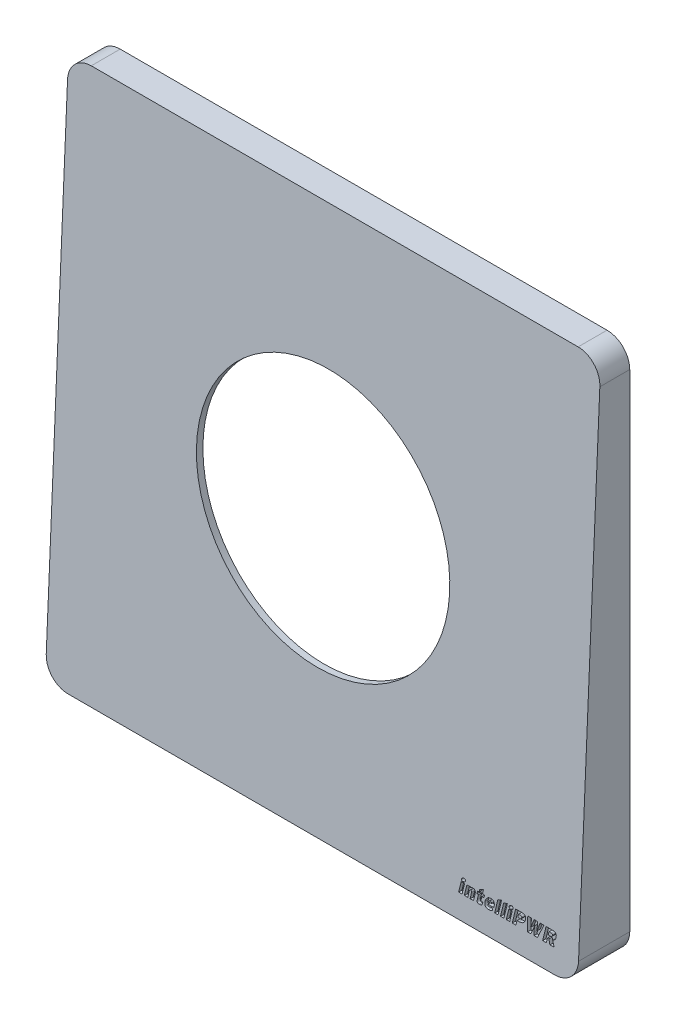
from build123d import *

# Parameters (mm, degrees)
EXTRUDE_THIN1_DEPTH     = 8
CUT_EXTRUDE2_DEPTH      = 120
BOSS_EXTRUDE1_DEPTH     = 82
CUT_EXTRUDE_THIN1_DEPTH = 82
SKETCH8_R               = 19.5
CUT_EXTRUDE3_DEPTH      = 82
CUT_EXTRUDE13_DEPTH     = 0.5


with BuildPart() as part:
    # Sketch1 → Extrude-Thin1 (new body)
    with BuildSketch(Plane.XY):
        with BuildLine():
            Line((-37.5, 41), (37.5, 41))
            ThreePointArc((37.5, 41), (39.974873734, 39.974873734), (41, 37.5))
            Line((41, 37.5), (41, -37.5))
            ThreePointArc((41, -37.5), (39.974873734, -39.974873734), (37.5, -41))
            Line((37.5, -41), (-37.5, -41))
            ThreePointArc((-37.5, -41), (-39.974873734, -39.974873734), (-41, -37.5))
            Line((-41, -37.5), (-41, 37.5))
            ThreePointArc((-41, 37.5), (-39.974873734, 39.974873734), (-37.5, 41))
        make_face()
        with BuildLine():
            Line((-37.5, 40), (37.5, 40))
            ThreePointArc((37.5, 40), (39.267766953, 39.267766953), (40, 37.5))
            Line((40, 37.5), (40, -37.5))
            ThreePointArc((40, -37.5), (39.267766953, -39.267766953), (37.5, -40))
            Line((37.5, -40), (-37.5, -40))
            ThreePointArc((-37.5, -40), (-39.267766953, -39.267766953), (-40, -37.5))
            Line((-40, -37.5), (-40, 37.5))
            ThreePointArc((-40, 37.5), (-39.267766953, 39.267766953), (-37.5, 40))
        make_face(mode=Mode.SUBTRACT)
    extrude(amount=EXTRUDE_THIN1_DEPTH)

    # Sketch5 → Cut-Extrude2 (cut)
    with BuildSketch(Plane(origin=(41, 0, 0), x_dir=(0, 0, -1), z_dir=(1, 0, 0))):
        Polygon((-3.45625, 41), (-8, 41), (-8, -41), (-7.04375, -41), align=None)
    extrude(amount=-CUT_EXTRUDE2_DEPTH, mode=Mode.SUBTRACT)

    # Sketch6 → Boss-Extrude1 (add)
    with BuildSketch(Plane(origin=(41, 0, 0), x_dir=(0, 0, -1), z_dir=(1, 0, 0))):
        Polygon((-7.04375, -41), (-3.45625, 41), (-4.457206574, 41), (-8.044706574, -41), align=None)
    extrude(amount=-BOSS_EXTRUDE1_DEPTH)

    # Sketch7 → Cut-Extrude-Thin1 (cut)
    with BuildSketch(Plane(origin=(0, 0, 0), x_dir=(-1, 0, 0), z_dir=(0, 0, -1))):
        with BuildLine():
            Line((-37.5, 52), (37.5, 52))
            ThreePointArc((37.5, 52), (47.753048327, 47.753048327), (52, 37.5))
            Line((52, 37.5), (52, -37.5))
            ThreePointArc((52, -37.5), (47.753048327, -47.753048327), (37.5, -52))
            Line((37.5, -52), (-37.5, -52))
            ThreePointArc((-37.5, -52), (-47.753048327, -47.753048327), (-52, -37.5))
            Line((-52, -37.5), (-52, 37.5))
            ThreePointArc((-52, 37.5), (-47.753048327, 47.753048327), (-37.5, 52))
        make_face()
        with BuildLine():
            Line((-37.5, 41), (37.5, 41))
            ThreePointArc((37.5, 41), (39.974873734, 39.974873734), (41, 37.5))
            Line((41, 37.5), (41, -37.5))
            ThreePointArc((41, -37.5), (39.974873734, -39.974873734), (37.5, -41))
            Line((37.5, -41), (-37.5, -41))
            ThreePointArc((-37.5, -41), (-39.974873734, -39.974873734), (-41, -37.5))
            Line((-41, -37.5), (-41, 37.5))
            ThreePointArc((-41, 37.5), (-39.974873734, 39.974873734), (-37.5, 41))
        make_face(mode=Mode.SUBTRACT)
    extrude(amount=-CUT_EXTRUDE_THIN1_DEPTH, mode=Mode.SUBTRACT)

    # Sketch8 → Cut-Extrude3 (cut)
    with BuildSketch(Plane(origin=(0, 0.272956894, 6.23901471), x_dir=(1, 0, 0), z_dir=(0, 0.043708189893615426, 0.9990443404255007))):
        with Locations(Location((0, 0, 0), (0, 0, 270))):
            Circle(SKETCH8_R)
    extrude(amount=-CUT_EXTRUDE3_DEPTH, mode=Mode.SUBTRACT)

    # Sketch9 → Cut-Extrude13 (cut)
    # profile 1 of 12: a face of its own
    with BuildSketch(Plane(origin=(0, 0.272956894, 6.23901471), x_dir=(1, 0, 0), z_dir=(0, 0.043708189893615426, 0.9990443404255007))):
        Polygon((22.531822821, -37.81243752), (22.856252467, -36.277424239), (23.382446053, -36.277424239), (23.058016406, -37.81243752), align=None)
    # profile 2 of 12: a face of its own
    with BuildSketch(Plane(origin=(0, 0.272956894, 6.23901471), x_dir=(1, 0, 0), z_dir=(0, 0.043708189893615426, 0.9990443404255007))):
        with BuildLine():
            Line((24.290595271, -37.81243752), (24.474593832, -36.930090398))
            add(Edge.make_bspline(
                [(24.474593832, -36.930090398), (24.478802242, -36.907040936), (24.485699122, -36.874149701), (24.489204408, -36.831864189), (24.489786804, -36.805005948), (24.488227016, -36.781187681), (24.484505468, -36.760299642), (24.478846794, -36.742301837), (24.467897911, -36.722954035), (24.449713773, -36.703469949), (24.410825862, -36.680379912), (24.375667943, -36.67553935), (24.351928125, -36.675453309)],
                knots=[0, 0, 0, 0, 0.206248224, 0.294567954, 0.37266766, 0.442257727, 0.504010297, 0.558886264, 0.607164005, 0.698384721, 0.78958017, 1, 1, 1, 1], degree=3))
            add(Edge.make_bspline(
                [(24.351928125, -36.675453309), (24.325473284, -36.67484558), (24.286525614, -36.681302878), (24.239553647, -36.702765608), (24.213865624, -36.721381884), (24.194964801, -36.739763636), (24.182562108, -36.757605017), (24.170154917, -36.777822133), (24.158964314, -36.801354271), (24.147757062, -36.827440773), (24.134571616, -36.86862437), (24.125790697, -36.901180323), (24.120978207, -36.924168606)],
                knots=[0, 0, 0, 0, 0.211446307, 0.310998659, 0.41131055, 0.464021143, 0.521401463, 0.584741643, 0.653943237, 0.72987757, 0.812025534, 1, 1, 1, 1], degree=3))
            Line((24.120978207, -36.924168606), (23.936556661, -37.81243752))
            Line((23.936556661, -37.81243752), (23.410363076, -37.81243752))
            Line((23.410363076, -37.81243752), (23.734792722, -36.26938752))
            Line((23.734792722, -36.26938752), (24.260986308, -36.26938752))
            Line((24.260986308, -36.26938752), (24.240683018, -36.373441879))
            add(Edge.make_bspline(
                [(24.240683018, -36.373441879), (24.297987543, -36.33807022), (24.373085655, -36.296555731), (24.471607475, -36.262409613), (24.549233248, -36.246533575), (24.610636762, -36.242418025), (24.653093586, -36.242316467)],
                knots=[0, 0, 0, 0, 0.46054381, 0.581347921, 0.710250487, 1, 1, 1, 1], degree=3))
            add(Edge.make_bspline(
                [(24.653093586, -36.242316467), (24.692136802, -36.242431818), (24.748815156, -36.246238609), (24.8195399, -36.26391656), (24.865428391, -36.281339933), (24.906090192, -36.304634337), (24.94136314, -36.333047361), (24.971485528, -36.366619173), (24.996169238, -36.405109022), (25.015420474, -36.448469614), (25.030965908, -36.495857326), (25.040105685, -36.548112348), (25.04586972, -36.604390706), (25.045678226, -36.66521683), (25.04090151, -36.755484326), (25.027642856, -36.824675469), (25.018552796, -36.872141426)],
                knots=[0, 0, 0, 0, 0.133987507, 0.193275728, 0.24925757, 0.301629359, 0.35316106, 0.403792674, 0.455518759, 0.509134706, 0.565968881, 0.625945932, 0.6905051, 0.759590801, 0.83411591, 1, 1, 1, 1], degree=3))
            Line((25.018552796, -36.872141426), (24.819749753, -37.81243752))
            Line((24.819749753, -37.81243752), (24.290595271, -37.81243752))
        make_face()
    # profile 3 of 12: a face of its own
    with BuildSketch(Plane(origin=(0, 0.272956894, 6.23901471), x_dir=(1, 0, 0), z_dir=(0, 0.043708189893615426, 0.9990443404255007))):
        with BuildLine():
            Line((25.394586637, -37.347153803), (25.534594737, -36.675453309))
            Line((25.534594737, -36.675453309), (25.300683923, -36.675453309))
            Line((25.300683923, -36.675453309), (25.388664844, -36.26938752))
            Line((25.388664844, -36.26938752), (25.622575658, -36.26938752))
            Line((25.622575658, -36.26938752), (25.704211801, -35.881087109))
            Line((25.704211801, -35.881087109), (26.259591365, -35.673824362))
            Line((26.259591365, -35.673824362), (26.133964762, -36.26938752))
            Line((26.133964762, -36.26938752), (26.467277097, -36.26938752))
            Line((26.467277097, -36.26938752), (26.379719161, -36.675453309))
            Line((26.379719161, -36.675453309), (26.046406826, -36.675453309))
            Line((26.046406826, -36.675453309), (25.929239926, -37.238869592))
            add(Edge.make_bspline(
                [(25.929239926, -37.238869592), (25.923631424, -37.263216042), (25.918218034, -37.297200918), (25.92312076, -37.33870405), (25.933824276, -37.360093), (25.95091673, -37.374576816), (25.981808804, -37.389433205), (26.009637148, -37.390972473), (26.028641447, -37.391567249)],
                knots=[0, 0, 0, 0, 0.332431059, 0.451864296, 0.549008946, 0.641835514, 0.743993136, 1, 1, 1, 1], degree=3))
            add(Edge.make_bspline(
                [(26.028641447, -37.391567249), (26.064780722, -37.392002115), (26.110181113, -37.38175387), (26.162442535, -37.359627978), (26.203981464, -37.340089416), (26.235299865, -37.32233029), (26.257053454, -37.309931106)],
                knots=[0, 0, 0, 0, 0.43902333, 0.560347006, 0.693743593, 1, 1, 1, 1], degree=3))
            Line((26.257053454, -37.309931106), (26.092935197, -37.757449444))
            add(Edge.make_bspline(
                [(26.092935197, -37.757449444), (26.033275974, -37.783688944), (25.9542673, -37.808911724), (25.856030319, -37.827809595), (25.785408909, -37.836780083), (25.731643106, -37.839786288), (25.695329112, -37.839508573)],
                knots=[0, 0, 0, 0, 0.477930884, 0.605353718, 0.733676339, 1, 1, 1, 1], degree=3))
            add(Edge.make_bspline(
                [(25.695329112, -37.839508573), (25.663071209, -37.839736582), (25.616436461, -37.836590683), (25.557875684, -37.82439235), (25.519836592, -37.812291359), (25.486172578, -37.796278005), (25.456955472, -37.776434565), (25.431516542, -37.753616181), (25.410851111, -37.726296633), (25.394665646, -37.694759799), (25.38251301, -37.658826153), (25.374110771, -37.618366346), (25.370071442, -37.573117994), (25.370413325, -37.523190221), (25.37572401, -37.446876072), (25.386376133, -37.387870854), (25.394586637, -37.347153803)],
                knots=[0, 0, 0, 0, 0.137072389, 0.197691701, 0.253760369, 0.306270191, 0.355445666, 0.403353528, 0.450794793, 0.500090506, 0.553319674, 0.611470956, 0.675245672, 0.745926336, 0.823383702, 1, 1, 1, 1], degree=3))
        make_face()
    # profile 4 of 12: a face of its own
    with BuildSketch(Plane(origin=(0, 0.272956894, 6.23901471), x_dir=(1, 0, 0), z_dir=(0, 0.043708189893615426, 0.9990443404255007))):
        with BuildLine():
            Line((27.91938528, -37.189803309), (27.01927278, -37.189803309))
            add(Edge.make_bspline(
                [(27.01927278, -37.189803309), (27.015898274, -37.226457242), (27.01601409, -37.279183424), (27.03669972, -37.341985199), (27.061308535, -37.376691917), (27.093763275, -37.402446593), (27.147771512, -37.428419222), (27.19477816, -37.432833272), (27.226535526, -37.433442783)],
                knots=[0, 0, 0, 0, 0.296055755, 0.414655706, 0.524028038, 0.631630635, 0.743271398, 1, 1, 1, 1], degree=3))
            add(Edge.make_bspline(
                [(27.226535526, -37.433442783), (27.260304962, -37.433236623), (27.31067195, -37.43030854), (27.376808197, -37.419896308), (27.426276206, -37.409482171), (27.476966935, -37.393776547), (27.552204889, -37.368515828), (27.608599837, -37.34239729), (27.647828783, -37.325158573)],
                knots=[0, 0, 0, 0, 0.230947891, 0.344109465, 0.457558095, 0.576207715, 0.70668566, 1, 1, 1, 1], degree=3))
            Line((27.647828783, -37.325158573), (27.779377179, -37.663123745))
            add(Edge.make_bspline(
                [(27.779377179, -37.663123745), (27.727053342, -37.69106355), (27.647293355, -37.728389628), (27.538548692, -37.768901332), (27.457845603, -37.794776995), (27.375596177, -37.814738758), (27.261882842, -37.834279371), (27.174496056, -37.839220378), (27.115713405, -37.839508573)],
                knots=[0, 0, 0, 0, 0.256454148, 0.380104154, 0.501569382, 0.622663836, 0.745735429, 1, 1, 1, 1], degree=3))
            add(Edge.make_bspline(
                [(27.115713405, -37.839508573), (27.062179079, -37.839286621), (26.984150161, -37.83327018), (26.88635986, -37.808329984), (26.821962158, -37.782879161), (26.764092487, -37.750669591), (26.712897628, -37.712208672), (26.667893943, -37.668395916), (26.62986787, -37.618343197), (26.599121942, -37.56243437), (26.574364264, -37.501573328), (26.556779358, -37.435320793), (26.545435886, -37.364186815), (26.541005333, -37.288550103), (26.544084404, -37.180061075), (26.556760714, -37.097618609), (26.568793544, -37.042181476)],
                knots=[0, 0, 0, 0, 0.139838784, 0.202933442, 0.262718436, 0.320042211, 0.375233846, 0.429352927, 0.483441981, 0.53862135, 0.595400523, 0.654488518, 0.717096367, 0.783082629, 0.851912792, 1, 1, 1, 1], degree=3))
            add(Edge.make_bspline(
                [(26.568793544, -37.042181476), (26.583085354, -36.979206373), (26.60848624, -36.887640456), (26.655114524, -36.772897044), (26.694694701, -36.695308707), (26.738238344, -36.623502999), (26.786046479, -36.557832048), (26.837870332, -36.498114858), (26.893872235, -36.444840081), (26.953078454, -36.39729059), (27.015434303, -36.35616866), (27.080683136, -36.32115439), (27.14867641, -36.29247145), (27.219054765, -36.270059906), (27.315753588, -36.248224211), (27.39033929, -36.242847847), (27.440143051, -36.242316467)],
                knots=[0, 0, 0, 0, 0.150666393, 0.221012111, 0.28851275, 0.353592776, 0.416668091, 0.477731317, 0.537737092, 0.596692125, 0.65460536, 0.711686431, 0.769156404, 0.826456793, 0.883737364, 1, 1, 1, 1], degree=3))
            add(Edge.make_bspline(
                [(27.440143051, -36.242316467), (27.48922651, -36.24267976), (27.561151065, -36.24758194), (27.651468494, -36.270502973), (27.711979381, -36.293016875), (27.766658046, -36.323010534), (27.815967781, -36.359353432), (27.859729134, -36.4023055), (27.897814959, -36.451871329), (27.929209579, -36.508297206), (27.953961332, -36.571393781), (27.97038317, -36.641490792), (27.980634306, -36.717983158), (27.982669075, -36.801137222), (27.975856843, -36.92586239), (27.959950401, -37.021979864), (27.946033347, -37.087863877)],
                knots=[0, 0, 0, 0, 0.12523536, 0.182281535, 0.236835406, 0.289223704, 0.340575345, 0.392377008, 0.444879637, 0.499220359, 0.55630156, 0.616919283, 0.68212815, 0.752543466, 0.82841511, 1, 1, 1, 1], degree=3))
            add(Edge.make_bspline(
                [(27.946033347, -37.087863877), (27.940848511, -37.106752883), (27.933318431, -37.141050311), (27.92588395, -37.175490124), (27.91938528, -37.189803309)],
                knots=[0, 0, 0, 0, 0.556454368, 1, 1, 1, 1], degree=3))
        make_face()
        with BuildLine():
            Line((27.089065337, -36.864950678), (27.527700987, -36.864950678))
            add(Edge.make_bspline(
                [(27.527700987, -36.864950678), (27.529337401, -36.829487736), (27.529026457, -36.77893147), (27.514215784, -36.717849161), (27.500871129, -36.6876486), (27.487156087, -36.667260541), (27.473605439, -36.655183968), (27.4583103, -36.644290122), (27.440041106, -36.635904218), (27.419470388, -36.629193279), (27.387146007, -36.622924997), (27.361546751, -36.621026515), (27.343702426, -36.621311204)],
                knots=[0, 0, 0, 0, 0.296748963, 0.41669466, 0.52130206, 0.570189777, 0.620055625, 0.671541666, 0.72618717, 0.786738208, 0.851474558, 1, 1, 1, 1], degree=3))
            add(Edge.make_bspline(
                [(27.343702426, -36.621311204), (27.315511409, -36.621200824), (27.27322467, -36.62837339), (27.223193569, -36.654754005), (27.18938015, -36.682031228), (27.158746996, -36.716815862), (27.120773112, -36.776433731), (27.10084266, -36.828342644), (27.089065337, -36.864950678)],
                knots=[0, 0, 0, 0, 0.222963425, 0.331063086, 0.443598367, 0.564296996, 0.69558842, 1, 1, 1, 1], degree=3))
        make_face(mode=Mode.SUBTRACT)
    # profile 5 of 12: a face of its own
    with BuildSketch(Plane(origin=(0, 0.272956894, 6.23901471), x_dir=(1, 0, 0), z_dir=(0, 0.043708189893615426, 0.9990443404255007))):
        Polygon((28.08138861, -37.81243752), (28.4874544, -35.884893976), (29.057638446, -35.673824362), (28.607582196, -37.81243752), align=None)
    # profile 6 of 12: a face of its own
    with BuildSketch(Plane(origin=(0, 0.272956894, 6.23901471), x_dir=(1, 0, 0), z_dir=(0, 0.043708189893615426, 0.9990443404255007))):
        Polygon((28.974733347, -37.81243752), (29.380799137, -35.884893976), (29.950983183, -35.673824362), (29.500926933, -37.81243752), align=None)
    # profile 7 of 12: a face of its own
    with BuildSketch(Plane(origin=(0, 0.272956894, 6.23901471), x_dir=(1, 0, 0), z_dir=(0, 0.043708189893615426, 0.9990443404255007))):
        Polygon((29.868078084, -37.81243752), (30.19250773, -36.277424239), (30.718701316, -36.277424239), (30.394271669, -37.81243752), align=None)
    # profile 8 of 12: a face of its own
    with BuildSketch(Plane(origin=(0, 0.272956894, 6.23901471), x_dir=(1, 0, 0), z_dir=(0, 0.043708189893615426, 0.9990443404255007))):
        with BuildLine():
            Line((31.772780428, -37.135661204), (31.489380345, -37.135661204))
            Line((31.489380345, -37.135661204), (31.34894926, -37.81243752))
            Line((31.34894926, -37.81243752), (30.790608799, -37.81243752))
            Line((30.790608799, -37.81243752), (31.223322656, -35.75503752))
            Line((31.223322656, -35.75503752), (32.103131867, -35.75503752))
            add(Edge.make_bspline(
                [(32.103131867, -35.75503752), (32.159534536, -35.754461725), (32.241971066, -35.759373362), (32.34812403, -35.774557347), (32.42051447, -35.790648003), (32.487750703, -35.810772195), (32.548378699, -35.837608583), (32.602942888, -35.869231698), (32.650276048, -35.907283046), (32.691096218, -35.950762718), (32.72462258, -36.000691089), (32.750395085, -36.056994678), (32.768534882, -36.119550733), (32.779127087, -36.188477535), (32.781433901, -36.294101393), (32.769834596, -36.376142847), (32.758335937, -36.432236821)],
                knots=[0, 0, 0, 0, 0.14831325, 0.216934671, 0.281917028, 0.343283354, 0.401251238, 0.455965678, 0.508744428, 0.560452414, 0.612307896, 0.666251039, 0.722712036, 0.783153078, 0.849210812, 1, 1, 1, 1], degree=3))
            add(Edge.make_bspline(
                [(32.758335937, -36.432236821), (32.745018379, -36.493400096), (32.720669996, -36.582253241), (32.670543899, -36.690589416), (32.628175407, -36.76221581), (32.579864514, -36.826142449), (32.527763822, -36.884522206), (32.469918315, -36.935510004), (32.407912463, -36.980860955), (32.341061715, -37.019087162), (32.270613234, -37.052413334), (32.195941581, -37.079438209), (32.117438362, -37.100302612), (32.035627861, -37.116510214), (31.920519083, -37.130666622), (31.832448592, -37.136469779), (31.772780428, -37.135661204)],
                knots=[0, 0, 0, 0, 0.14135813, 0.206506788, 0.268663819, 0.328624165, 0.386922124, 0.444795496, 0.502155746, 0.559848074, 0.618159034, 0.677698161, 0.738624222, 0.801161417, 0.865596376, 1, 1, 1, 1], degree=3))
        make_face()
        with BuildLine():
            Line((31.992309745, -36.215245415), (31.685222492, -36.215245415))
            Line((31.685222492, -36.215245415), (31.58582097, -36.675453309))
            Line((31.58582097, -36.675453309), (31.884025535, -36.675453309))
            add(Edge.make_bspline(
                [(31.884025535, -36.675453309), (31.925283313, -36.675209328), (31.984662794, -36.670227561), (32.055154824, -36.644667406), (32.096879938, -36.618845247), (32.130162263, -36.584340573), (32.167941671, -36.52744984), (32.183954356, -36.476480956), (32.191112788, -36.44111951)],
                knots=[0, 0, 0, 0, 0.290619666, 0.412091533, 0.523258856, 0.631698278, 0.745850168, 1, 1, 1, 1], degree=3))
            add(Edge.make_bspline(
                [(32.191112788, -36.44111951), (32.198110418, -36.410987258), (32.203090618, -36.36614806), (32.190734347, -36.310322247), (32.175987355, -36.281723428), (32.160016208, -36.261866207), (32.144631485, -36.249338003), (32.126367347, -36.238587545), (32.105357328, -36.229711955), (32.081040299, -36.223694155), (32.043444894, -36.216386171), (32.013189918, -36.215204357), (31.992309745, -36.215245415)],
                knots=[0, 0, 0, 0, 0.254137898, 0.360692933, 0.46331412, 0.514097368, 0.56812747, 0.624481852, 0.687008785, 0.753851467, 0.828927712, 1, 1, 1, 1], degree=3))
        make_face(mode=Mode.SUBTRACT)
    # profile 9 of 12: a face of its own
    with BuildSketch(Plane(origin=(0, 0.272956894, 6.23901471), x_dir=(1, 0, 0), z_dir=(0, 0.043708189893615426, 0.9990443404255007))):
        with BuildLine():
            Line((34.659231414, -37.81243752), (34.129230962, -37.81243752))
            Line((34.129230962, -37.81243752), (34.129230962, -37.365765152))
            add(Edge.make_bspline(
                [(34.129230962, -37.365765152), (34.126900951, -37.283994804), (34.128252893, -37.160536588), (34.13547643, -36.997616177), (34.140789961, -36.879311843), (34.146666584, -36.769053746), (34.151864415, -36.683348569), (34.155460175, -36.621114495), (34.160496198, -36.570625063), (34.164210151, -36.535200839), (34.167722615, -36.513449979)],
                knots=[0, 0, 0, 0, 0.287418182, 0.433706581, 0.573086252, 0.703582808, 0.821711634, 0.874841658, 0.922616611, 1, 1, 1, 1], degree=3))
            add(Edge.make_bspline(
                [(34.167722615, -36.513449979), (34.161496588, -36.535520096), (34.149299246, -36.570573469), (34.134017602, -36.621303223), (34.118978254, -36.666114788), (34.103325378, -36.714945055), (34.085340593, -36.766621059), (34.066093035, -36.820983598), (34.03725522, -36.897664284), (33.9987844, -36.997892012), (33.933873577, -37.161042447), (33.883548654, -37.284308092), (33.849214762, -37.365765152)],
                knots=[0, 0, 0, 0, 0.075537836, 0.122272145, 0.174582572, 0.231301047, 0.291254257, 0.354891756, 0.421348915, 0.56122885, 0.708689565, 1, 1, 1, 1], degree=3))
            Line((33.849214762, -37.365765152), (33.661832319, -37.81243752))
            Line((33.661832319, -37.81243752), (33.144521423, -37.81243752))
            Line((33.144521423, -37.81243752), (33.089110362, -35.75503752))
            Line((33.089110362, -35.75503752), (33.673675905, -35.75503752))
            Line((33.673675905, -35.75503752), (33.656333512, -36.098924485))
            add(Edge.make_bspline(
                [(33.656333512, -36.098924485), (33.65424701, -36.174983918), (33.648264891, -36.290478133), (33.63833161, -36.445240669), (33.629727747, -36.562669926), (33.621321528, -36.67807013), (33.607761646, -36.820968946), (33.598473633, -36.925344182), (33.591616776, -36.992269222)],
                knots=[0, 0, 0, 0, 0.254778508, 0.38725736, 0.519329184, 0.649081567, 0.774717154, 1, 1, 1, 1], degree=3))
            add(Edge.make_bspline(
                [(33.591616776, -36.992269222), (33.61165122, -36.925090754), (33.64627647, -36.821122294), (33.699313362, -36.68033524), (33.744037038, -36.566523172), (33.79127081, -36.450651757), (33.852019877, -36.294789455), (33.898907874, -36.178549694), (33.930850905, -36.101885382)],
                knots=[0, 0, 0, 0, 0.220629604, 0.344767136, 0.47349051, 0.605507784, 0.738597758, 1, 1, 1, 1], degree=3))
            Line((33.930850905, -36.101885382), (34.074242887, -35.75503752))
            Line((34.074242887, -35.75503752), (34.600436472, -35.75503752))
            Line((34.600436472, -35.75503752), (34.597475576, -36.101885382))
            add(Edge.make_bspline(
                [(34.597475576, -36.101885382), (34.595245322, -36.17885342), (34.593744967, -36.295183632), (34.59170112, -36.450432417), (34.58933481, -36.566770504), (34.585265185, -36.680726113), (34.576970765, -36.822355136), (34.568781216, -36.925808509), (34.562367804, -36.992269222)],
                knots=[0, 0, 0, 0, 0.259139328, 0.391547022, 0.522548461, 0.650759617, 0.775290273, 1, 1, 1, 1], degree=3))
            add(Edge.make_bspline(
                [(34.562367804, -36.992269222), (34.582394712, -36.924994766), (34.615222507, -36.82040396), (34.663469422, -36.677898334), (34.702776993, -36.562353946), (34.74497043, -36.44495472), (34.802596037, -36.290539958), (34.846106719, -36.175456577), (34.872415954, -36.098924485)],
                knots=[0, 0, 0, 0, 0.222643769, 0.347663635, 0.477213716, 0.609762054, 0.743343773, 1, 1, 1, 1], degree=3))
            Line((34.872415954, -36.098924485), (35.001003454, -35.75503752))
            Line((35.001003454, -35.75503752), (35.580070189, -35.75503752))
            Line((35.580070189, -35.75503752), (34.659231414, -37.81243752))
        make_face()
    # profile 10 of 12: a face of its own
    with BuildSketch(Plane(origin=(0, 0.272956894, 6.23901471), x_dir=(1, 0, 0), z_dir=(0, 0.043708189893615426, 0.9990443404255007))):
        with BuildLine():
            Line((36.593542722, -37.81243752), (36.406583265, -37.135661204))
            Line((36.406583265, -37.135661204), (36.178594243, -37.135661204))
            Line((36.178594243, -37.135661204), (36.032241365, -37.81243752))
            Line((36.032241365, -37.81243752), (35.473900905, -37.81243752))
            Line((35.473900905, -37.81243752), (35.906614762, -35.75503752))
            Line((35.906614762, -35.75503752), (36.821531743, -35.75503752))
            add(Edge.make_bspline(
                [(36.821531743, -35.75503752), (36.877926873, -35.754483807), (36.960384904, -35.759332471), (37.066505033, -35.774612626), (37.139020737, -35.790466145), (37.205953379, -35.811436437), (37.266900634, -35.837465743), (37.321219528, -35.86927989), (37.368651198, -35.906963709), (37.409975253, -35.949728838), (37.443119472, -35.999356773), (37.469792369, -36.054460359), (37.488179297, -36.116142105), (37.499234619, -36.184069182), (37.502091304, -36.288441986), (37.491138593, -36.369579554), (37.479273725, -36.425046073)],
                knots=[0, 0, 0, 0, 0.149105791, 0.218093904, 0.283423508, 0.345229253, 0.403357541, 0.458364359, 0.511192647, 0.563160888, 0.614984401, 0.668362726, 0.724518171, 0.784604297, 0.849908347, 1, 1, 1, 1], degree=3))
            add(Edge.make_bspline(
                [(37.479273725, -36.425046073), (37.471091951, -36.462370246), (37.457436855, -36.517331944), (37.43109931, -36.586817422), (37.410288931, -36.63589911), (37.386568462, -36.682146783), (37.360046921, -36.725521274), (37.331535273, -36.766605713), (37.289678358, -36.81710195), (37.232396706, -36.874721204), (37.129930057, -36.955845139), (37.043268199, -37.00306597), (36.982266118, -37.027799979)],
                knots=[0, 0, 0, 0, 0.140674907, 0.207617019, 0.273117689, 0.336661801, 0.398557529, 0.459984484, 0.520402942, 0.639569431, 0.758047993, 1, 1, 1, 1], degree=3))
            Line((36.982266118, -37.027799979), (37.228020518, -37.81243752))
            Line((37.228020518, -37.81243752), (36.593542722, -37.81243752))
        make_face()
        with BuildLine():
            Line((36.710709622, -36.215245415), (36.368514597, -36.215245415))
            Line((36.368514597, -36.215245415), (36.272073972, -36.675453309))
            Line((36.272073972, -36.675453309), (36.605386308, -36.675453309))
            add(Edge.make_bspline(
                [(36.605386308, -36.675453309), (36.646692183, -36.675332321), (36.705978767, -36.670056218), (36.776403605, -36.643820336), (36.817731516, -36.616951584), (36.851342385, -36.58260588), (36.88863205, -36.525830349), (36.904630746, -36.475608567), (36.912050576, -36.440696525)],
                knots=[0, 0, 0, 0, 0.291424493, 0.412585485, 0.525065724, 0.635142904, 0.748168098, 1, 1, 1, 1], degree=3))
            add(Edge.make_bspline(
                [(36.912050576, -36.440696525), (36.917844475, -36.411390256), (36.922675548, -36.366980493), (36.90794214, -36.31244527), (36.893225565, -36.28331352), (36.876706606, -36.263321356), (36.861459444, -36.249962849), (36.842692221, -36.239762671), (36.822035314, -36.229989575), (36.797925906, -36.22366887), (36.760859123, -36.216450838), (36.731169116, -36.215191251), (36.710709622, -36.215245415)],
                knots=[0, 0, 0, 0, 0.248424975, 0.356513751, 0.46136469, 0.51411026, 0.569240084, 0.626959334, 0.689288847, 0.756873603, 0.831295405, 1, 1, 1, 1], degree=3))
        make_face(mode=Mode.SUBTRACT)
    # profile 11 of 12: a face of its own
    with BuildSketch(Plane(origin=(0, 0.272956894, 6.23901471), x_dir=(1, 0, 0), z_dir=(0, 0.043708189893615426, 0.9990443404255007))):
        with BuildLine():
            add(Edge.make_bspline(
                [(23.50511176, -35.900967413), (23.49691936, -35.939534043), (23.47504383, -35.995133722), (23.425881126, -36.056740916), (23.380038303, -36.094110103), (23.328076843, -36.124265142), (23.249409757, -36.153091049), (23.185884765, -36.161544068), (23.142613446, -36.161103309)],
                knots=[0, 0, 0, 0, 0.243996234, 0.362518467, 0.483923593, 0.607810429, 0.732572499, 1, 1, 1, 1], degree=3))
            add(Edge.make_bspline(
                [(23.142613446, -36.161103309), (23.103364668, -36.161400076), (23.046373744, -36.154280511), (22.979352972, -36.124674591), (22.945948828, -36.099189041), (22.924597095, -36.074893347), (22.910930194, -36.055259817), (22.901500015, -36.033273015), (22.894040832, -36.01010401), (22.890391407, -35.984987846), (22.889303064, -35.948291927), (22.893286288, -35.92001209), (22.897282031, -35.900967413)],
                knots=[0, 0, 0, 0, 0.278361244, 0.398908763, 0.514847654, 0.572097947, 0.627438768, 0.683254165, 0.740686715, 0.799243397, 0.862127538, 1, 1, 1, 1], degree=3))
            add(Edge.make_bspline(
                [(22.897282031, -35.900967413), (22.90463722, -35.864843953), (22.926908821, -35.812948349), (22.975049057, -35.754537867), (23.02082171, -35.717115039), (23.07287559, -35.686103781), (23.14944575, -35.654434845), (23.212194736, -35.647389995), (23.253858553, -35.646753309)],
                knots=[0, 0, 0, 0, 0.233168972, 0.351345779, 0.477078281, 0.606225183, 0.734604908, 1, 1, 1, 1], degree=3))
            add(Edge.make_bspline(
                [(23.253858553, -35.646753309), (23.294043937, -35.647611873), (23.353611721, -35.652601871), (23.421520668, -35.685173743), (23.454901582, -35.711763501), (23.475557012, -35.736857178), (23.489276756, -35.75628574), (23.498634374, -35.777727473), (23.506206896, -35.800008962), (23.51029148, -35.823685041), (23.51182755, -35.85767362), (23.50937443, -35.883664153), (23.50511176, -35.900967413)],
                knots=[0, 0, 0, 0, 0.289932119, 0.415109387, 0.533191086, 0.591068146, 0.646913169, 0.702320899, 0.757398382, 0.814668092, 0.873137526, 1, 1, 1, 1], degree=3))
        make_face()
    # profile 12 of 12: a face of its own
    with BuildSketch(Plane(origin=(0, 0.272956894, 6.23901471), x_dir=(1, 0, 0), z_dir=(0, 0.043708189893615426, 0.9990443404255007))):
        with BuildLine():
            add(Edge.make_bspline(
                [(30.841367023, -35.900967413), (30.833174623, -35.939534043), (30.811299094, -35.995133722), (30.762136389, -36.056740916), (30.716293567, -36.094110103), (30.664332107, -36.124265142), (30.58566502, -36.153091049), (30.522140028, -36.161544068), (30.478868709, -36.161103309)],
                knots=[0, 0, 0, 0, 0.243996234, 0.362518467, 0.483923593, 0.607810429, 0.732572499, 1, 1, 1, 1], degree=3))
            add(Edge.make_bspline(
                [(30.478868709, -36.161103309), (30.439619931, -36.161400076), (30.382629007, -36.154280511), (30.315608235, -36.124674591), (30.282204092, -36.099189041), (30.260852358, -36.074893347), (30.247185457, -36.055259817), (30.237755278, -36.033273015), (30.230296095, -36.01010401), (30.226646671, -35.984987846), (30.225558327, -35.948291927), (30.229541551, -35.92001209), (30.233537294, -35.900967413)],
                knots=[0, 0, 0, 0, 0.278361244, 0.398908763, 0.514847654, 0.572097947, 0.627438768, 0.683254165, 0.740686715, 0.799243397, 0.862127538, 1, 1, 1, 1], degree=3))
            add(Edge.make_bspline(
                [(30.233537294, -35.900967413), (30.240892483, -35.864843953), (30.263164084, -35.812948349), (30.31130432, -35.754537867), (30.357076973, -35.717115039), (30.409130853, -35.686103781), (30.485701013, -35.654434845), (30.54845, -35.647389995), (30.590113816, -35.646753309)],
                knots=[0, 0, 0, 0, 0.233168972, 0.351345779, 0.477078281, 0.606225183, 0.734604908, 1, 1, 1, 1], degree=3))
            add(Edge.make_bspline(
                [(30.590113816, -35.646753309), (30.6302992, -35.647611873), (30.689866985, -35.652601871), (30.757775931, -35.685173743), (30.791156845, -35.711763501), (30.811812275, -35.736857178), (30.825532019, -35.75628574), (30.834889637, -35.777727473), (30.842462159, -35.800008962), (30.846546743, -35.823685041), (30.848082813, -35.85767362), (30.845629693, -35.883664153), (30.841367023, -35.900967413)],
                knots=[0, 0, 0, 0, 0.289932119, 0.415109387, 0.533191086, 0.591068146, 0.646913169, 0.702320899, 0.757398382, 0.814668092, 0.873137526, 1, 1, 1, 1], degree=3))
        make_face()
    extrude(amount=-CUT_EXTRUDE13_DEPTH, mode=Mode.SUBTRACT)


solid = part.part
